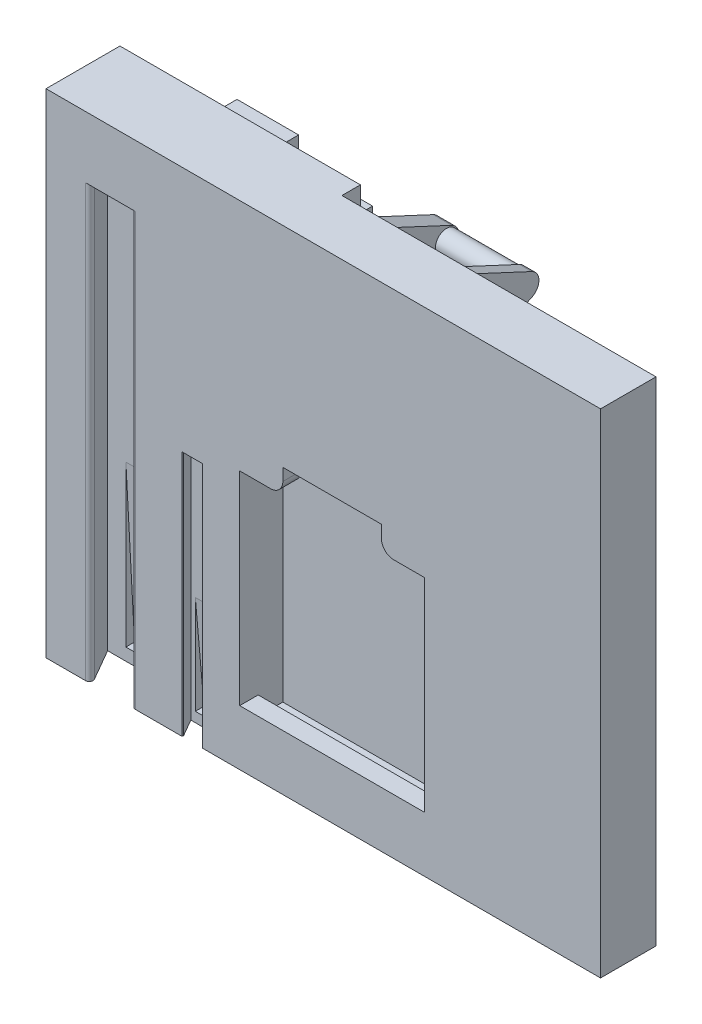
from build123d import *

# Parameters (mm, degrees)
SKETCH1_W           = 45
SKETCH1_H           = 40
BOSS_EXTRUDE1_DEPTH = 6
CUT_EXTRUDE1_DEPTH  = 35
FILLET4_R           = 0.3
CUT_EXTRUDE4_DEPTH  = 20
CHAMFER1_SIZE       = 0.1
SKETCH10_W          = 25.487766081
SKETCH10_H          = 1.5
CUT_EXTRUDE8_DEPTH  = 47.284446632
CUT_EXTRUDE9_DEPTH  = 1.75
CUT_EXTRUDE10_DEPTH = 1.25
SKETCH13_W          = 15
SKETCH13_H          = 20
CUT_EXTRUDE11_DEPTH = 3.5
SKETCH14_W          = 15
SKETCH14_H          = 1.5
SKETCH14_W_2        = 3.5
SKETCH14_H_2        = 2
BOSS_EXTRUDE2_DEPTH = 1.5
FILLET5_R           = 1
SKETCH15_R          = 0.9
BOSS_EXTRUDE3_DEPTH = 1.5
BOSS_EXTRUDE4_START = 7
SKETCH15_3_R        = 0.9
BOSS_EXTRUDE4_DEPTH = 1
SKETCH15_4_R        = 0.9
BOSS_EXTRUDE5_DEPTH = 8
BOSS_EXTRUDE6_START = -3
BOSS_EXTRUDE6_DEPTH = 20
BOSS_EXTRUDE7_DEPTH = 2.5
BOSS_EXTRUDE8_DEPTH = 5


with BuildPart() as part:
    # Sketch1 → Boss-Extrude1 (new body)
    with BuildSketch(Plane.XY):
        Rectangle(SKETCH1_W, SKETCH1_H)
    extrude(amount=BOSS_EXTRUDE1_DEPTH)

    # Sketch2 → Cut-Extrude1 (cut)
    with BuildSketch(Plane.XZ.offset(20)):
        Polygon((-15.767949192, 6), (-14.035898385, 3), (-20.5, 3), (-18.767949192, 6), align=None)
    extrude(amount=-CUT_EXTRUDE1_DEPTH, mode=Mode.SUBTRACT)

    # Fillet4
    fillet4_edges = [part.edges().sort_by_distance(p)[0] for p in [
        (-18.767949192, -2.5, 6),
        (-15.767949192, -2.5, 6),
    ]]
    fillet(fillet4_edges, radius=FILLET4_R)

    # Sketch5 → Cut-Extrude4 (cut)
    with BuildSketch(Plane.XZ.offset(20)):
        Polygon((-9.882308546, 6), (-9.016283143, 4.5), (-12.24833395, 4.5), (-11.382308546, 6), align=None)
    extrude(amount=-CUT_EXTRUDE4_DEPTH, mode=Mode.SUBTRACT)

    # Chamfer1
    chamfer1_edges = [part.edges().sort_by_distance(p)[0] for p in [
        (-11.382308546, -10, 6),
        (-9.882308546, -10, 6),
    ]]
    chamfer(chamfer1_edges, length=CHAMFER1_SIZE)

    # Sketch10 → Cut-Extrude8 (cut, through all)
    with BuildSketch(Plane.XZ.offset(20)):
        with Locations((9.756116959, 0.75)):
            Rectangle(SKETCH10_W, SKETCH10_H)
    extrude(amount=-CUT_EXTRUDE8_DEPTH, mode=Mode.SUBTRACT)

    # Sketch11 → Cut-Extrude9 (cut, symmetric)
    with BuildSketch(Plane(origin=(-17.267949192, 0, 0), x_dir=(0, 0, -1), z_dir=(1, 0, 0))):
        Polygon((-3, -19), (-3, -6), (-2.3, -19), align=None)
    extrude(amount=CUT_EXTRUDE9_DEPTH, both=True, mode=Mode.SUBTRACT)

    # Sketch12 → Cut-Extrude10 (cut, symmetric)
    with BuildSketch(Plane(origin=(-10.632308546, 0, 0), x_dir=(0, 0, -1), z_dir=(1, 0, 0))):
        Polygon((-4.5, -19.2), (-4.5, -11.198963388), (-3.8, -19.2), align=None)
    extrude(amount=CUT_EXTRUDE10_DEPTH, both=True, mode=Mode.SUBTRACT)

    # Sketch13 → Cut-Extrude11 (cut)
    with BuildSketch(Plane.XY.offset(6)):
        with Locations((0.717691454, -7)):
            Rectangle(SKETCH13_W, SKETCH13_H)
    extrude(amount=-CUT_EXTRUDE11_DEPTH, mode=Mode.SUBTRACT)

    # Sketch14 → Boss-Extrude2 (add)
    with BuildSketch(Plane.XY.offset(6)):
        with Locations((0.717691454, -16.25)):
            Rectangle(SKETCH14_W, SKETCH14_H)
        with Locations((-5.032308546, 2)):
            Rectangle(SKETCH14_W_2, SKETCH14_H_2)
        with Locations((6.467691454, 2)):
            Rectangle(SKETCH14_W_2, SKETCH14_H_2)
    extrude(amount=-BOSS_EXTRUDE2_DEPTH)

    # Fillet5
    fillet5_edges = [part.edges().sort_by_distance(p)[0] for p in [
        (-3.282308546, 1, 5.25),
        (4.717691454, 1, 5.25),
    ]]
    fillet(fillet5_edges, radius=FILLET5_R)

    # Sketch15 → Boss-Extrude3 (add)
    # profile 1 of 2: a face of its own
    with BuildSketch(Plane(origin=(0, 0, 0), x_dir=(0, 0, -1), z_dir=(1, 0, 0))):
        with BuildLine():
            Line((2.922618262, 16.125083661), (-1.5, 14.062782897))
            Line((-1.5, 14.062782897), (-1.5, 20))
            Line((-1.5, 20), (2.922618262, 17.937699235))
            ThreePointArc((2.922618262, 17.937699235), (3.5, 17.031391448), (2.922618262, 16.125083661))
        make_face()
        with Locations((2.5, 17.031391448)):
            Circle(SKETCH15_R, mode=Mode.SUBTRACT)
    # profile 2 of 2: a face of its own
    with BuildSketch(Plane(origin=(0, 0, 0), x_dir=(0, 0, -1), z_dir=(1, 0, 0))):
        with BuildLine():
            ThreePointArc((2.922618262, -2.062300765), (3.5, -2.968608552), (2.922618262, -3.874916339))
            Line((2.922618262, -3.874916339), (-1.5, -5.937217103))
            Line((-1.5, -5.937217103), (-1.5, 0))
            Line((-1.5, 0), (2.922618262, -2.062300765))
        make_face()
        with Locations((2.5, -2.968608552)):
            Circle(SKETCH15_R, mode=Mode.SUBTRACT)
    extrude(amount=BOSS_EXTRUDE3_DEPTH)

    # Sketch15<3> → Boss-Extrude4 (add)
    # profile 1 of 2: a face of its own
    with BuildSketch(Plane(origin=(0, 0, 0), x_dir=(0, 0, -1), z_dir=(1, 0, 0)).offset(BOSS_EXTRUDE4_START)):
        with BuildLine():
            ThreePointArc((2.922618262, -2.062300765), (3.5, -2.968608552), (2.922618262, -3.874916339))
            Line((2.922618262, -3.874916339), (-1.5, -5.937217103))
            Line((-1.5, -5.937217103), (-1.5, 0))
            Line((-1.5, 0), (2.922618262, -2.062300765))
        make_face()
        with Locations((2.5, -2.968608552)):
            Circle(SKETCH15_3_R, mode=Mode.SUBTRACT)
    # profile 2 of 2: a face of its own
    with BuildSketch(Plane(origin=(0, 0, 0), x_dir=(0, 0, -1), z_dir=(1, 0, 0)).offset(BOSS_EXTRUDE4_START)):
        with BuildLine():
            Line((2.922618262, 16.125083661), (-1.5, 14.062782897))
            Line((-1.5, 14.062782897), (-1.5, 20))
            Line((-1.5, 20), (2.922618262, 17.937699235))
            ThreePointArc((2.922618262, 17.937699235), (3.5, 17.031391448), (2.922618262, 16.125083661))
        make_face()
        with Locations((2.5, 17.031391448)):
            Circle(SKETCH15_3_R, mode=Mode.SUBTRACT)
    extrude(amount=BOSS_EXTRUDE4_DEPTH)

    # Sketch15<4> → Boss-Extrude5 (add)
    with BuildSketch(Plane(origin=(0, 0, 0), x_dir=(0, 0, -1), z_dir=(1, 0, 0))):
        with Locations((2.5, 17.031391448)):
            Circle(SKETCH15_4_R)
        with Locations((2.5, -2.968608552)):
            Circle(SKETCH15_4_R)
    extrude(amount=BOSS_EXTRUDE5_DEPTH)

    # Sketch16 → Boss-Extrude6 (add)
    with BuildSketch(Plane(origin=(0, 20, 0), x_dir=(1, 0, 0), z_dir=(0, 1, 0)).offset(BOSS_EXTRUDE6_START)):
        with BuildLine():
            Line((-21, 1), (-21, 2))
            Line((-21, 2), (-18.5, 2))
            Line((-18.5, 2), (-18.5, 1))
            Line((-18.5, 1), (-20, 1))
            Line((-20, 1), (-20, 0))
            Line((-20, 0), (-22, 0))
            ThreePointArc((-22, 0), (-21.292893219, 0.292893219), (-21, 1))
        make_face()
        with BuildLine():
            Line((-5, 0), (-3, 0))
            ThreePointArc((-3, 0), (-3.707106781, 0.292893219), (-4, 1))
            Line((-4, 1), (-4, 2))
            Line((-4, 2), (-6.5, 2))
            Line((-6.5, 2), (-6.5, 1))
            Line((-6.5, 1), (-5, 1))
            Line((-5, 1), (-5, 0))
        make_face()
    extrude(amount=-BOSS_EXTRUDE6_DEPTH)

    # Sketch18 → Boss-Extrude7 (add, symmetric)
    with BuildSketch(Plane(origin=(-12.5, 0, 0), x_dir=(0, 0, 1), z_dir=(1, 0, 0))):
        with BuildLine():
            Line((-1, -19), (-2, -19))
            Line((-2, -19), (-2, -17))
            Line((-2, -17), (-1, -17))
            Line((-1, -17), (-1, -18))
            Line((-1, -18), (0, -18))
            Line((0, -18), (0, -20))
            ThreePointArc((0, -20), (-0.292893219, -19.292893219), (-1, -19))
        make_face()
    extrude(amount=BOSS_EXTRUDE7_DEPTH, both=True)

    # Sketch19 → Boss-Extrude8 (add, symmetric)
    with BuildSketch(Plane(origin=(-12.5, 0, 0), x_dir=(0, 0, -1), z_dir=(1, 0, 0))):
        with BuildLine():
            Line((0, -7.5), (1, -7.5))
            ThreePointArc((1, -7.5), (1.5, -8), (1, -8.5))
            Line((1, -8.5), (0, -8.5))
            Line((0, -8.5), (0, -7.5))
        make_face()
    extrude(amount=BOSS_EXTRUDE8_DEPTH, both=True)


solid = part.part
